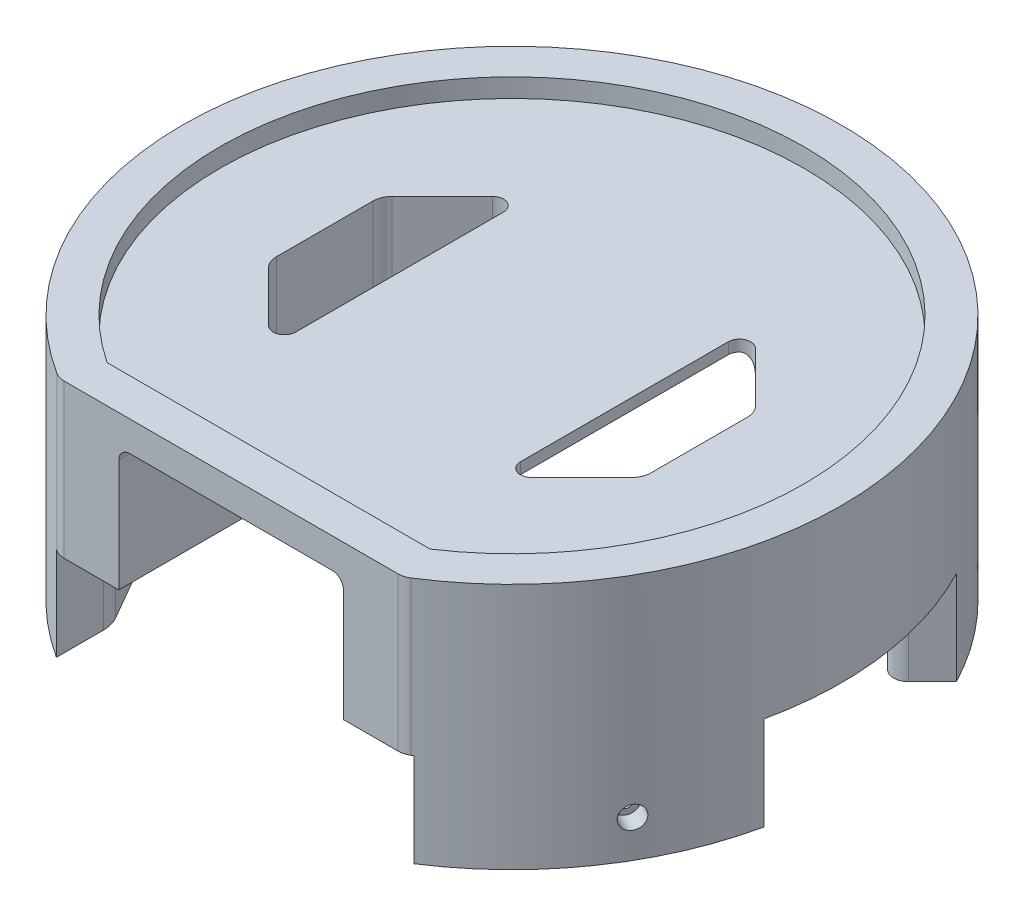
from build123d import *

# Parameters (mm, degrees)
BOSS_EXTRUDE1_DEPTH     = 66
CUT_EXTRUDE3_DEPTH      = 25
CUT_EXTRUDE3_DEPTH_BACK = 10
FILLET1_R               = 4
FILLET3_R               = 9
SKETCH4_W               = 60
SKETCH4_H               = 150
CUT_EXTRUDE4_DEPTH      = 33
CUT_EXTRUDE5_DEPTH      = 5
CUT_EXTRUDE6_DEPTH      = 132.030530793
FILLET5_R               = 3
FILLET6_R               = 5
FILLET7_R               = 3
SKETCH7_R               = 1.5
CUT_EXTRUDE7_DEPTH      = 198.739948877
SKETCH11_R              = 3
CUT_EXTRUDE10_DEPTH     = 210.0771447
SKETCH8_R               = 1.5
CUT_EXTRUDE8_DEPTH      = 205.670582053
SKETCH10_R              = 3
CUT_EXTRUDE9_DEPTH      = 216.914390172
FILLET10_R              = 5


with BuildPart() as part:
    # Sketch3 → Boss-Extrude1 (new body)
    with BuildSketch(Plane(origin=(0, 0, 0), x_dir=(1, 0, 0), z_dir=(0, 1, 0))):
        with BuildLine():
            Line((-46.032597146, -75), (46.032597146, -75))
            ThreePointArc((46.032597146, -75), (0, 88), (-46.032597146, -75))
        make_face()
    extrude(amount=BOSS_EXTRUDE1_DEPTH)

    # Sketch2 → Cut-Extrude3 (cut, two sides: drawn at the far end of the back side and taken through both)
    with BuildSketch(Plane(origin=(0, 0, 0), x_dir=(1, 0, 0), z_dir=(0, 1, 0)).offset(-CUT_EXTRUDE3_DEPTH_BACK)):
        with BuildLine():
            Line((68.882903046, 31.406243643), (31.406243643, 68.882903046))
            Line((31.406243643, 68.882903046), (40.598631798, 78.075291201))
            ThreePointArc((40.598631798, 78.075291201), (0, 88), (-40.598631798, 78.075291201))
            Line((-40.598631798, 78.075291201), (-31.406243643, 68.882903046))
            Line((-31.406243643, 68.882903046), (-68.882903046, 31.406243643))
            Line((-68.882903046, 31.406243643), (-78.075291201, 40.598631798))
            ThreePointArc((-78.075291201, 40.598631798), (-87.22877857, 11.624981252), (-85.982636075, -18.734628196))
            Line((-85.982636075, -18.734628196), (-74.724305826, -12.234628196))
            Line((-74.724305826, -12.234628196), (-47.724305826, -59))
            Line((-47.724305826, -59), (-47.724305826, -73.935043338))
            ThreePointArc((-47.724305826, -73.935043338), (-46.881475519, -74.472325418), (-46.032597146, -75))
            ThreePointArc((-46.032597146, -75), (0, -88), (46.032597146, -75))
            ThreePointArc((46.032597146, -75), (46.881475519, -74.472325418), (47.724305826, -73.935043338))
            Line((47.724305826, -73.935043338), (47.724305826, -59))
            Line((47.724305826, -59), (74.724305826, -12.234628196))
            Line((74.724305826, -12.234628196), (85.982636075, -18.734628196))
            ThreePointArc((85.982636075, -18.734628196), (87.49420545, -9.421465529), (88, 0))
            ThreePointArc((88, 0), (85.482821741, 20.897061687), (78.075291201, 40.598631798))
            Line((78.075291201, 40.598631798), (68.882903046, 31.406243643))
        make_face()
    extrude(amount=CUT_EXTRUDE3_DEPTH + CUT_EXTRUDE3_DEPTH_BACK, mode=Mode.SUBTRACT)

    # Fillet1
    fillet1_edges = [part.edges().sort_by_distance(p)[0] for p in [
        (74.724305826, 12.5, 12.234628196),
        (68.882903046, 12.5, -31.406243643),
        (31.406243643, 12.5, -68.882903046),
        (-31.406243643, 12.5, -68.882903046),
        (-68.882903046, 12.5, -31.406243643),
        (-74.724305826, 12.5, 12.234628196),
    ]]
    fillet(fillet1_edges, radius=FILLET1_R)

    # Fillet3
    fillet3_edges = [part.edges().sort_by_distance(p)[0] for p in [
        (47.724305826, 12.5, 59),
        (-47.724305826, 12.5, 59),
    ]]
    fillet(fillet3_edges, radius=FILLET3_R)

    # Sketch4 → Cut-Extrude4 (cut)
    with BuildSketch(Plane.XZ.offset(-25)):
        Rectangle(SKETCH4_W, SKETCH4_H)
        with BuildLine():
            Line((30, -75), (-30, -75))
            ThreePointArc((-30, -75), (0, -80.777472107), (30, -75))
        make_face()
    extrude(amount=-CUT_EXTRUDE4_DEPTH, mode=Mode.SUBTRACT)

    # Sketch5 → Cut-Extrude5 (cut)
    with BuildSketch(Plane(origin=(0, 66, 0), x_dir=(1, 0, 0), z_dir=(0, 1, 0))):
        with BuildLine():
            Line((-43.116122275, -65), (43.116122275, -65))
            ThreePointArc((43.116122275, -65), (0, 78), (-43.116122275, -65))
        make_face()
    extrude(amount=-CUT_EXTRUDE5_DEPTH, mode=Mode.SUBTRACT)

    # Sketch6 → Cut-Extrude6 (cut, through all)
    with BuildSketch(Plane.XZ.offset(-25)):
        Polygon((30, 35), (50, 15), (50, -15), (30, -35), align=None)
        Polygon((-50, -15), (-30, -35), (-30, 35), (-50, 15), align=None)
    extrude(amount=-CUT_EXTRUDE6_DEPTH, mode=Mode.SUBTRACT)

    # Fillet5
    fillet5_edges = [part.edges().sort_by_distance(p)[0] for p in [
        (30, 59.5, -35),
        (30, 59.5, 35),
        (-30, 59.5, 35),
        (-30, 59.5, -35),
    ]]
    fillet(fillet5_edges, radius=FILLET5_R)

    # Fillet6
    fillet6_edges = [part.edges().sort_by_distance(p)[0] for p in [
        (30, 41.5, -35),
        (30, 41.5, 35),
        (50, 43, 15),
        (50, 43, -15),
        (-30, 41.5, 35),
        (-50, 43, -15),
        (-50, 43, 15),
        (-30, 41.5, -35),
    ]]
    fillet(fillet6_edges, radius=FILLET6_R)

    # Fillet7
    fillet7_edges = [part.edges().sort_by_distance(p)[0] for p in [
        (-30, 41.5, -75),
        (30, 58, -56.035533906),
        (0, 58, -80.777472107),
        (30, 41.5, -75),
        (-30, 58, -56.035533906),
        (-33.292893219, 58, 31.707106781),
        (33.292893219, 58, -31.707106781),
        (33.292893219, 58, 31.707106781),
        (30, 58, 56.035533906),
        (-30, 58, 56.035533906),
        (-33.292893219, 58, -31.707106781),
        (30.380602337, 58, -35.15765065),
        (30.380602337, 58, 35.15765065),
        (-30.380602337, 58, 35.15765065),
        (-30.380602337, 58, -35.15765065),
    ]]
    fillet(fillet7_edges, radius=FILLET7_R)

    # Sketch7 → Cut-Extrude7 (cut, through all)
    with BuildSketch(Plane(origin=(50.144573344, 0, -50.144573344), x_dir=(0.7071067811865472, 0, 0.7071067811865478), z_dir=(-0.7071067811865478, 0, 0.7071067811865472))):
        with Locations((0, 10)):
            Circle(SKETCH7_R)
    cut_extrude7 = extrude(amount=-CUT_EXTRUDE7_DEPTH, mode=Mode.SUBTRACT)

    # Sketch11 → Cut-Extrude10 (cut, through all)
    with BuildSketch(Plane(origin=(58.629854718, 0, -58.629854718), x_dir=(0.7071067811865472, 0, 0.7071067811865478), z_dir=(-0.7071067811865478, 0, 0.7071067811865472))):
        with Locations((0, 10)):
            Circle(SKETCH11_R)
    cut_extrude10 = extrude(amount=-CUT_EXTRUDE10_DEPTH, mode=Mode.SUBTRACT)

    # Sketch8 → Cut-Extrude8 (cut, through all)
    with BuildSketch(Plane(origin=(61.340978781, 0, 35.415230611), x_dir=(-0.5000000000000003, 0, 0.8660254037844386), z_dir=(-0.8660254037844385, 0, -0.5000000000000002))):
        with Locations((0, 10)):
            Circle(SKETCH8_R)
    cut_extrude8 = extrude(amount=-CUT_EXTRUDE8_DEPTH, mode=Mode.SUBTRACT)

    # Sketch10 → Cut-Extrude9 (cut, through all)
    with BuildSketch(Plane(origin=(71.733283626, 0, 41.415230611), x_dir=(-0.5000000000000003, 0, 0.8660254037844386), z_dir=(-0.8660254037844385, 0, -0.5000000000000002))):
        with Locations((0, 10)):
            Circle(SKETCH10_R)
    cut_extrude9 = extrude(amount=-CUT_EXTRUDE9_DEPTH, mode=Mode.SUBTRACT)

    # Mirror1: Cut-Extrude7, Cut-Extrude10, Cut-Extrude8, Cut-Extrude9 across plane
    add(cut_extrude7.mirror(Plane(origin=(0, 0, 0), x_dir=(0, 0, 1), z_dir=(1, 0, 0))), mode=Mode.SUBTRACT)
    add(cut_extrude10.mirror(Plane(origin=(0, 0, 0), x_dir=(0, 0, 1), z_dir=(1, 0, 0))), mode=Mode.SUBTRACT)
    add(cut_extrude8.mirror(Plane(origin=(0, 0, 0), x_dir=(0, 0, 1), z_dir=(1, 0, 0))), mode=Mode.SUBTRACT)
    add(cut_extrude9.mirror(Plane(origin=(0, 0, 0), x_dir=(0, 0, 1), z_dir=(1, 0, 0))), mode=Mode.SUBTRACT)

    # Fillet10
    fillet10_edges = [part.edges().sort_by_distance(p)[0] for p in [
        (46.032597146, 45.5, 75),
        (-46.032597146, 45.5, 75),
    ]]
    fillet(fillet10_edges, radius=FILLET10_R)


solid = part.part
